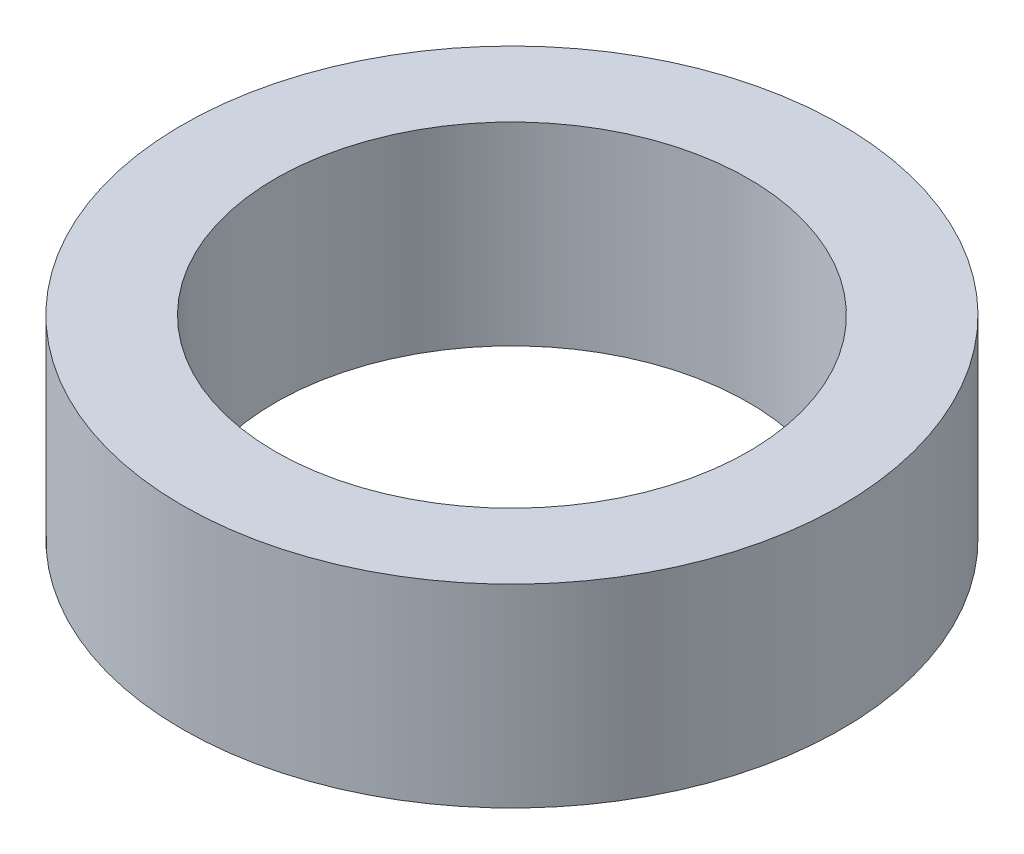
from build123d import *

# Parameters (mm, degrees)
SPACER_RING_SKETCH_R   = 8.5
SPACER_RING_SKETCH_R_2 = 6.1
SPACER_RING_DEPTH      = 5


with BuildPart() as part:
    # Spacer ring sketch → Spacer ring (new body)
    with BuildSketch(Plane(origin=(0, -149, 0), x_dir=(1, 0, 0), z_dir=(0, 1, 0))):
        with Locations(Location((-56.291651246, 0, 0), (0, 0, 270))):
            Circle(SPACER_RING_SKETCH_R)
        with Locations(Location((-56.291651246, 0, 0), (0, 0, 270))):
            Circle(SPACER_RING_SKETCH_R_2, mode=Mode.SUBTRACT)
    extrude(amount=SPACER_RING_DEPTH)


solid = part.part
